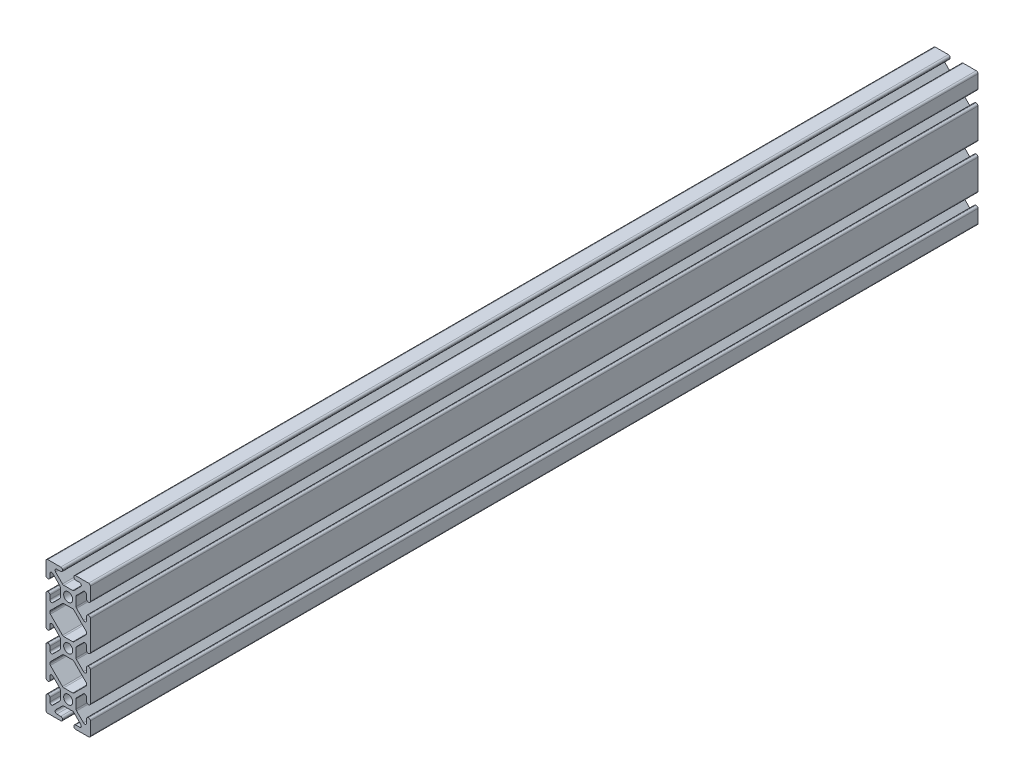
from build123d import *

# Parameters (mm, degrees)
SKETCH1_R            = 2.6035
MAIN_EXTRUSION_DEPTH = 254


with BuildPart() as part:
    # Sketch1 → Main Extrusion (new, symmetric)
    with BuildSketch(Plane.XY):
        with BuildLine():
            Line((-12.7, 37.084), (-12.7, 29.6672))
            ThreePointArc((-12.7, 29.6672), (-12.40242049, 28.94877951), (-11.684, 28.6512))
            Line((-11.684, 28.6512), (-11.5062, 28.6512))
            ThreePointArc((-11.5062, 28.6512), (-10.78777951, 28.94877951), (-10.4902, 29.6672))
            Line((-10.4902, 29.6672), (-10.4902, 31.874794456))
            ThreePointArc((-10.4902, 31.874794456), (-9.863006367, 32.813456061), (-8.75577951, 32.593214945))
            Line((-8.75577951, 32.593214945), (-4.81877951, 28.656214945))
            ThreePointArc((-4.81877951, 28.656214945), (-4.598538395, 28.326600823), (-4.5212, 27.937794456))
            Line((-4.5212, 27.937794456), (-4.5212, 22.862205544))
            ThreePointArc((-4.5212, 22.862205544), (-4.598538395, 22.473399177), (-4.81877951, 22.143785055))
            Line((-4.81877951, 22.143785055), (-8.75577951, 18.206785055))
            ThreePointArc((-8.75577951, 18.206785055), (-9.863006367, 17.986543939), (-10.4902, 18.925205544))
            Line((-10.4902, 18.925205544), (-10.4902, 21.1328))
            ThreePointArc((-10.4902, 21.1328), (-10.78777951, 21.85122049), (-11.5062, 22.1488))
            Line((-11.5062, 22.1488), (-11.684, 22.1488))
            ThreePointArc((-11.684, 22.1488), (-12.40242049, 21.85122049), (-12.7, 21.1328))
            Line((-12.7, 21.1328), (-12.7, 4.2672))
            ThreePointArc((-12.7, 4.2672), (-12.40242049, 3.54877951), (-11.684, 3.2512))
            Line((-11.684, 3.2512), (-11.5062, 3.2512))
            ThreePointArc((-11.5062, 3.2512), (-10.78777951, 3.54877951), (-10.4902, 4.2672))
            Line((-10.4902, 4.2672), (-10.4902, 6.474794456))
            ThreePointArc((-10.4902, 6.474794456), (-9.863006367, 7.413456061), (-8.75577951, 7.193214945))
            Line((-8.75577951, 7.193214945), (-4.81877951, 3.256214945))
            ThreePointArc((-4.81877951, 3.256214945), (-4.598538395, 2.926600823), (-4.5212, 2.537794456))
            Line((-4.5212, 2.537794456), (-4.5212, -2.537794456))
            ThreePointArc((-4.5212, -2.537794456), (-4.598538395, -2.926600823), (-4.81877951, -3.256214945))
            Line((-4.81877951, -3.256214945), (-8.75577951, -7.193214945))
            ThreePointArc((-8.75577951, -7.193214945), (-9.863006367, -7.413456061), (-10.4902, -6.474794456))
            Line((-10.4902, -6.474794456), (-10.4902, -4.2672))
            ThreePointArc((-10.4902, -4.2672), (-10.78777951, -3.54877951), (-11.5062, -3.2512))
            Line((-11.5062, -3.2512), (-11.684, -3.2512))
            ThreePointArc((-11.684, -3.2512), (-12.40242049, -3.54877951), (-12.7, -4.2672))
            Line((-12.7, -4.2672), (-12.7, -21.1328))
            ThreePointArc((-12.7, -21.1328), (-12.40242049, -21.85122049), (-11.684, -22.1488))
            Line((-11.684, -22.1488), (-11.5062, -22.1488))
            ThreePointArc((-11.5062, -22.1488), (-10.78777951, -21.85122049), (-10.4902, -21.1328))
            Line((-10.4902, -21.1328), (-10.4902, -18.925205544))
            ThreePointArc((-10.4902, -18.925205544), (-9.863006367, -17.986543939), (-8.75577951, -18.206785055))
            Line((-8.75577951, -18.206785055), (-4.81877951, -22.143785055))
            ThreePointArc((-4.81877951, -22.143785055), (-4.598538395, -22.473399177), (-4.5212, -22.862205544))
            Line((-4.5212, -22.862205544), (-4.5212, -27.937794456))
            ThreePointArc((-4.5212, -27.937794456), (-4.598538395, -28.326600823), (-4.81877951, -28.656214945))
            Line((-4.81877951, -28.656214945), (-8.75577951, -32.593214945))
            ThreePointArc((-8.75577951, -32.593214945), (-9.863006367, -32.813456061), (-10.4902, -31.874794456))
            Line((-10.4902, -31.874794456), (-10.4902, -29.6672))
            ThreePointArc((-10.4902, -29.6672), (-10.78777951, -28.94877951), (-11.5062, -28.6512))
            Line((-11.5062, -28.6512), (-11.684, -28.6512))
            ThreePointArc((-11.684, -28.6512), (-12.40242049, -28.94877951), (-12.7, -29.6672))
            Line((-12.7, -29.6672), (-12.7, -37.084))
            ThreePointArc((-12.7, -37.084), (-12.40242049, -37.80242049), (-11.684, -38.1))
            Line((-11.684, -38.1), (-4.2672, -38.1))
            ThreePointArc((-4.2672, -38.1), (-3.54877951, -37.80242049), (-3.2512, -37.084))
            Line((-3.2512, -37.084), (-3.2512, -36.9062))
            ThreePointArc((-3.2512, -36.9062), (-3.54877951, -36.18777951), (-4.2672, -35.8902))
            Line((-4.2672, -35.8902), (-6.474794456, -35.8902))
            ThreePointArc((-6.474794456, -35.8902), (-7.413456061, -35.263006367), (-7.193214945, -34.15577951))
            Line((-7.193214945, -34.15577951), (-3.256214945, -30.21877951))
            ThreePointArc((-3.256214945, -30.21877951), (-2.926600823, -29.998538395), (-2.537794456, -29.9212))
            Line((-2.537794456, -29.9212), (2.537794456, -29.9212))
            ThreePointArc((2.537794456, -29.9212), (2.926600823, -29.998538395), (3.256214945, -30.21877951))
            Line((3.256214945, -30.21877951), (7.193214945, -34.15577951))
            ThreePointArc((7.193214945, -34.15577951), (7.413456061, -35.263006367), (6.474794456, -35.8902))
            Line((6.474794456, -35.8902), (4.2672, -35.8902))
            ThreePointArc((4.2672, -35.8902), (3.54877951, -36.18777951), (3.2512, -36.9062))
            Line((3.2512, -36.9062), (3.2512, -37.084))
            ThreePointArc((3.2512, -37.084), (3.54877951, -37.80242049), (4.2672, -38.1))
            Line((4.2672, -38.1), (11.684, -38.1))
            ThreePointArc((11.684, -38.1), (12.40242049, -37.80242049), (12.7, -37.084))
            Line((12.7, -37.084), (12.7, -29.6672))
            ThreePointArc((12.7, -29.6672), (12.40242049, -28.94877951), (11.684, -28.6512))
            Line((11.684, -28.6512), (11.5062, -28.6512))
            ThreePointArc((11.5062, -28.6512), (10.78777951, -28.94877951), (10.4902, -29.6672))
            Line((10.4902, -29.6672), (10.4902, -31.874794456))
            ThreePointArc((10.4902, -31.874794456), (9.863006367, -32.813456061), (8.75577951, -32.593214945))
            Line((8.75577951, -32.593214945), (4.81877951, -28.656214945))
            ThreePointArc((4.81877951, -28.656214945), (4.598538395, -28.326600823), (4.5212, -27.937794456))
            Line((4.5212, -27.937794456), (4.5212, -22.862205544))
            ThreePointArc((4.5212, -22.862205544), (4.598538395, -22.473399177), (4.81877951, -22.143785055))
            Line((4.81877951, -22.143785055), (8.75577951, -18.206785055))
            ThreePointArc((8.75577951, -18.206785055), (9.863006367, -17.986543939), (10.4902, -18.925205544))
            Line((10.4902, -18.925205544), (10.4902, -21.1328))
            ThreePointArc((10.4902, -21.1328), (10.78777951, -21.85122049), (11.5062, -22.1488))
            Line((11.5062, -22.1488), (11.684, -22.1488))
            ThreePointArc((11.684, -22.1488), (12.40242049, -21.85122049), (12.7, -21.1328))
            Line((12.7, -21.1328), (12.7, -4.2672))
            ThreePointArc((12.7, -4.2672), (12.40242049, -3.54877951), (11.684, -3.2512))
            Line((11.684, -3.2512), (11.5062, -3.2512))
            ThreePointArc((11.5062, -3.2512), (10.78777951, -3.54877951), (10.4902, -4.2672))
            Line((10.4902, -4.2672), (10.4902, -6.474794456))
            ThreePointArc((10.4902, -6.474794456), (9.863006367, -7.413456061), (8.75577951, -7.193214945))
            Line((8.75577951, -7.193214945), (4.81877951, -3.256214945))
            ThreePointArc((4.81877951, -3.256214945), (4.598538395, -2.926600823), (4.5212, -2.537794456))
            Line((4.5212, -2.537794456), (4.5212, 2.537794456))
            ThreePointArc((4.5212, 2.537794456), (4.598538395, 2.926600823), (4.81877951, 3.256214945))
            Line((4.81877951, 3.256214945), (8.75577951, 7.193214945))
            ThreePointArc((8.75577951, 7.193214945), (9.863006367, 7.413456061), (10.4902, 6.474794456))
            Line((10.4902, 6.474794456), (10.4902, 4.2672))
            ThreePointArc((10.4902, 4.2672), (10.78777951, 3.54877951), (11.5062, 3.2512))
            Line((11.5062, 3.2512), (11.684, 3.2512))
            ThreePointArc((11.684, 3.2512), (12.40242049, 3.54877951), (12.7, 4.2672))
            Line((12.7, 4.2672), (12.7, 21.1328))
            ThreePointArc((12.7, 21.1328), (12.40242049, 21.85122049), (11.684, 22.1488))
            Line((11.684, 22.1488), (11.5062, 22.1488))
            ThreePointArc((11.5062, 22.1488), (10.78777951, 21.85122049), (10.4902, 21.1328))
            Line((10.4902, 21.1328), (10.4902, 18.925205544))
            ThreePointArc((10.4902, 18.925205544), (9.863006367, 17.986543939), (8.75577951, 18.206785055))
            Line((8.75577951, 18.206785055), (4.81877951, 22.143785055))
            ThreePointArc((4.81877951, 22.143785055), (4.598538395, 22.473399177), (4.5212, 22.862205544))
            Line((4.5212, 22.862205544), (4.5212, 27.937794456))
            ThreePointArc((4.5212, 27.937794456), (4.598538395, 28.326600823), (4.81877951, 28.656214945))
            Line((4.81877951, 28.656214945), (8.75577951, 32.593214945))
            ThreePointArc((8.75577951, 32.593214945), (9.863006367, 32.813456061), (10.4902, 31.874794456))
            Line((10.4902, 31.874794456), (10.4902, 29.6672))
            ThreePointArc((10.4902, 29.6672), (10.78777951, 28.94877951), (11.5062, 28.6512))
            Line((11.5062, 28.6512), (11.684, 28.6512))
            ThreePointArc((11.684, 28.6512), (12.40242049, 28.94877951), (12.7, 29.6672))
            Line((12.7, 29.6672), (12.7, 37.084))
            ThreePointArc((12.7, 37.084), (12.40242049, 37.80242049), (11.684, 38.1))
            Line((11.684, 38.1), (4.2672, 38.1))
            ThreePointArc((4.2672, 38.1), (3.54877951, 37.80242049), (3.2512, 37.084))
            Line((3.2512, 37.084), (3.2512, 36.9062))
            ThreePointArc((3.2512, 36.9062), (3.54877951, 36.18777951), (4.2672, 35.8902))
            Line((4.2672, 35.8902), (6.474794456, 35.8902))
            ThreePointArc((6.474794456, 35.8902), (7.413456061, 35.263006367), (7.193214945, 34.15577951))
            Line((7.193214945, 34.15577951), (3.256214945, 30.21877951))
            ThreePointArc((3.256214945, 30.21877951), (2.926600823, 29.998538395), (2.537794456, 29.9212))
            Line((2.537794456, 29.9212), (-2.537794456, 29.9212))
            ThreePointArc((-2.537794456, 29.9212), (-2.926600823, 29.998538395), (-3.256214945, 30.21877951))
            Line((-3.256214945, 30.21877951), (-7.193214945, 34.15577951))
            ThreePointArc((-7.193214945, 34.15577951), (-7.413456061, 35.263006367), (-6.474794456, 35.8902))
            Line((-6.474794456, 35.8902), (-4.2672, 35.8902))
            ThreePointArc((-4.2672, 35.8902), (-3.54877951, 36.18777951), (-3.2512, 36.9062))
            Line((-3.2512, 36.9062), (-3.2512, 37.084))
            ThreePointArc((-3.2512, 37.084), (-3.54877951, 37.80242049), (-4.2672, 38.1))
            Line((-4.2672, 38.1), (-11.684, 38.1))
            ThreePointArc((-11.684, 38.1), (-12.40242049, 37.80242049), (-12.7, 37.084))
        make_face()
        with Locations((0, 25.4)):
            Circle(SKETCH1_R, mode=Mode.SUBTRACT)
        Circle(SKETCH1_R, mode=Mode.SUBTRACT)
        with Locations((0, -25.4)):
            Circle(SKETCH1_R, mode=Mode.SUBTRACT)
        with BuildLine():
            Line((-10.4902, 12.473605544), (-10.4902, 12.926394456))
            ThreePointArc((-10.4902, 12.926394456), (-10.412861605, 13.315200823), (-10.19262049, 13.644814945))
            Line((-10.19262049, 13.644814945), (-3.256214945, 20.58122049))
            ThreePointArc((-3.256214945, 20.58122049), (-2.926600823, 20.801461605), (-2.537794456, 20.8788))
            Line((-2.537794456, 20.8788), (2.537794456, 20.8788))
            ThreePointArc((2.537794456, 20.8788), (2.926600823, 20.801461605), (3.256214945, 20.58122049))
            Line((3.256214945, 20.58122049), (10.19262049, 13.644814945))
            ThreePointArc((10.19262049, 13.644814945), (10.412861605, 13.315200823), (10.4902, 12.926394456))
            Line((10.4902, 12.926394456), (10.4902, 12.473605544))
            ThreePointArc((10.4902, 12.473605544), (10.412861605, 12.084799177), (10.19262049, 11.755185055))
            Line((10.19262049, 11.755185055), (3.256214945, 4.81877951))
            ThreePointArc((3.256214945, 4.81877951), (2.926600823, 4.598538395), (2.537794456, 4.5212))
            Line((2.537794456, 4.5212), (-2.537794456, 4.5212))
            ThreePointArc((-2.537794456, 4.5212), (-2.926600823, 4.598538395), (-3.256214945, 4.81877951))
            Line((-3.256214945, 4.81877951), (-10.19262049, 11.755185055))
            ThreePointArc((-10.19262049, 11.755185055), (-10.412861605, 12.084799177), (-10.4902, 12.473605544))
        make_face(mode=Mode.SUBTRACT)
        with BuildLine():
            Line((-2.537794456, -4.5212), (2.537794456, -4.5212))
            ThreePointArc((2.537794456, -4.5212), (2.926600823, -4.598538395), (3.256214945, -4.81877951))
            Line((3.256214945, -4.81877951), (10.19262049, -11.755185055))
            ThreePointArc((10.19262049, -11.755185055), (10.412861605, -12.084799177), (10.4902, -12.473605544))
            Line((10.4902, -12.473605544), (10.4902, -12.926394456))
            ThreePointArc((10.4902, -12.926394456), (10.412861605, -13.315200823), (10.19262049, -13.644814945))
            Line((10.19262049, -13.644814945), (3.256214945, -20.58122049))
            ThreePointArc((3.256214945, -20.58122049), (2.926600823, -20.801461605), (2.537794456, -20.8788))
            Line((2.537794456, -20.8788), (-2.537794456, -20.8788))
            ThreePointArc((-2.537794456, -20.8788), (-2.926600823, -20.801461605), (-3.256214945, -20.58122049))
            Line((-3.256214945, -20.58122049), (-10.19262049, -13.644814945))
            ThreePointArc((-10.19262049, -13.644814945), (-10.412861605, -13.315200823), (-10.4902, -12.926394456))
            Line((-10.4902, -12.926394456), (-10.4902, -12.473605544))
            ThreePointArc((-10.4902, -12.473605544), (-10.412861605, -12.084799177), (-10.19262049, -11.755185055))
            Line((-10.19262049, -11.755185055), (-3.256214945, -4.81877951))
            ThreePointArc((-3.256214945, -4.81877951), (-2.926600823, -4.598538395), (-2.537794456, -4.5212))
        make_face(mode=Mode.SUBTRACT)
    extrude(amount=MAIN_EXTRUSION_DEPTH, both=True)


solid = part.part
